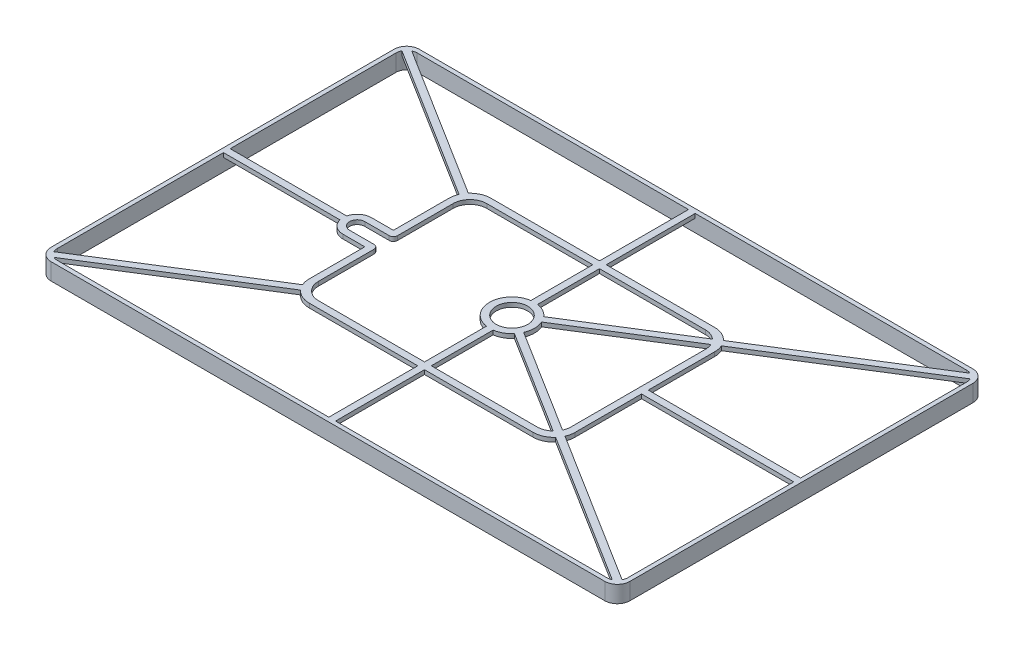
from build123d import *

# Parameters (mm, degrees)
BOSS_EXTRU_1_DEPTH      = 4
ESQUISSE2_R             = 3.75
BOSS_EXTRU_3_DEPTH      = 1
BOSS_EXTRU_4_DEPTH      = 1
ENL_V_MAT_EXTRU_1_DEPTH = 82.630279309
CONG_1_R                = 1


with BuildPart() as part:
    # Esquisse1 → Boss.-Extru.1 (new body)
    with BuildSketch(Plane(origin=(0, 0, 0), x_dir=(1, 0, 0), z_dir=(0, 1, 0))):
        with BuildLine():
            Line((-65.8, 43.75), (65.8, 43.75))
            ThreePointArc((65.8, 43.75), (67.921320344, 42.871320344), (68.8, 40.75))
            Line((68.8, 40.75), (68.8, -40.75))
            ThreePointArc((68.8, -40.75), (67.921320344, -42.871320344), (65.8, -43.75))
            Line((65.8, -43.75), (-65.8, -43.75))
            ThreePointArc((-65.8, -43.75), (-67.921320344, -42.871320344), (-68.8, -40.75))
            Line((-68.8, -40.75), (-68.8, 40.75))
            ThreePointArc((-68.8, 40.75), (-67.921320344, 42.871320344), (-65.8, 43.75))
        make_face()
        with BuildLine():
            Line((-65.3, 42.75), (65.3, 42.75))
            ThreePointArc((65.3, 42.75), (67.067766953, 42.017766953), (67.8, 40.25))
            Line((67.8, 40.25), (67.8, -40.25))
            ThreePointArc((67.8, -40.25), (67.067766953, -42.017766953), (65.3, -42.75))
            Line((65.3, -42.75), (-65.3, -42.75))
            ThreePointArc((-65.3, -42.75), (-67.067766953, -42.017766953), (-67.8, -40.25))
            Line((-67.8, -40.25), (-67.8, 40.25))
            ThreePointArc((-67.8, 40.25), (-67.067766953, 42.017766953), (-65.3, 42.75))
        make_face(mode=Mode.SUBTRACT)
    extrude(amount=BOSS_EXTRU_1_DEPTH)

    # Esquisse2 → Boss.-Extru.3 (add)
    with BuildSketch(Plane(origin=(0, 4, 0), x_dir=(1, 0, 0), z_dir=(0, 1, 0))):
        with BuildLine():
            Line((31.185394692, 18.593528409), (67.917224545, 41.605916277))
            Line((67.917224545, 41.605916277), (67.067766953, 42.961800416))
            Line((67.067766953, 42.961800416), (30.320844752, 19.939957235))
            ThreePointArc((30.320844752, 19.939957235), (28.637181119, 21.166168316), (26.6, 21.6))
            Line((26.6, 21.6), (0.8, 21.6))
            Line((0.8, 21.6), (0.8, 43.322975794))
            Line((0.8, 43.322975794), (-0.8, 43.322975794))
            Line((-0.8, 43.322975794), (-0.8, 21.6))
            Line((-0.8, 21.6), (-26.6, 21.6))
            ThreePointArc((-26.6, 21.6), (-28.637181119, 21.166168316), (-30.320844752, 19.939957235))
            Line((-30.320844752, 19.939957235), (-67.067766953, 42.961800416))
            Line((-67.067766953, 42.961800416), (-67.917224545, 41.605916277))
            Line((-67.917224545, 41.605916277), (-31.185394692, 18.593528409))
            ThreePointArc((-31.185394692, 18.593528409), (-31.495251447, 17.618092958), (-31.6, 16.6))
            Line((-31.6, 16.6), (-31.6, 0.8))
            Line((-31.6, 0.8), (-68.322644777, 0.8))
            Line((-68.322644777, 0.8), (-68.322644777, -0.8))
            Line((-68.322644777, -0.8), (-31.6, -0.8))
            Line((-31.6, -0.8), (-31.6, -16.6))
            ThreePointArc((-31.6, -16.6), (-31.495251447, -17.618092958), (-31.185394692, -18.593528409))
            Line((-31.185394692, -18.593528409), (-67.921921264, -41.608858758))
            Line((-67.921921264, -41.608858758), (-67.072463672, -42.964742898))
            Line((-67.072463672, -42.964742898), (-30.320844752, -19.939957235))
            ThreePointArc((-30.320844752, -19.939957235), (-28.637181119, -21.166168316), (-26.6, -21.6))
            Line((-26.6, -21.6), (-0.8, -21.6))
            Line((-0.8, -21.6), (-0.8, -43.218261979))
            Line((-0.8, -43.218261979), (0.8, -43.218261979))
            Line((0.8, -43.218261979), (0.8, -21.6))
            Line((0.8, -21.6), (26.6, -21.6))
            ThreePointArc((26.6, -21.6), (28.637181119, -21.166168316), (30.320844752, -19.939957235))
            Line((30.320844752, -19.939957235), (66.872148546, -42.839246036))
            Line((66.872148546, -42.839246036), (67.721606138, -41.483361896))
            Line((67.721606138, -41.483361896), (31.185394692, -18.593528409))
            ThreePointArc((31.185394692, -18.593528409), (31.495251447, -17.618092958), (31.6, -16.6))
            Line((31.6, -16.6), (31.6, -0.8))
            Line((31.6, -0.8), (68.284636361, -0.8))
            Line((68.284636361, -0.8), (68.284636361, 0.8))
            Line((68.284636361, 0.8), (31.6, 0.8))
            Line((31.6, 0.8), (31.6, 16.6))
            ThreePointArc((31.6, 16.6), (31.495251447, 17.618092958), (31.185394692, 18.593528409))
        make_face()
        with Locations(Location((0, 0, 0), (0, 0, 270))):
            Circle(ESQUISSE2_R, mode=Mode.SUBTRACT)
        with BuildLine():
            Line((-26, 20), (-0.8, 20))
            Line((-0.8, 20), (-0.8, 5.289848769))
            ThreePointArc((-0.8, 5.289848769), (-5.35, 0), (-0.8, -5.289848769))
            Line((-0.8, -5.289848769), (-0.8, -20))
            Line((-0.8, -20), (-26, -20))
            ThreePointArc((-26, -20), (-28.828427125, -18.828427125), (-30, -16))
            Line((-30, -16), (-30, 16))
            ThreePointArc((-30, 16), (-28.828427125, 18.828427125), (-26, 20))
        make_face(mode=Mode.SUBTRACT)
        with BuildLine():
            Line((30, 16), (30, -16))
            ThreePointArc((30, -16), (29.91194143, -16.834694103), (29.651642878, -17.632637221))
            Line((29.651642878, -17.632637221), (4.907492575, -2.130496802))
            ThreePointArc((4.907492575, -2.130496802), (5.35, 0), (4.907492575, 2.130496802))
            Line((4.907492575, 2.130496802), (29.651642878, 17.632637221))
            ThreePointArc((29.651642878, 17.632637221), (29.91194143, 16.834694103), (30, 16))
        make_face(mode=Mode.SUBTRACT)
        with BuildLine():
            Line((0.8, 20), (0.8, 5.289848769))
            ThreePointArc((0.8, 5.289848769), (2.590994023, 4.680731778), (4.058034983, 3.486380942))
            Line((4.058034983, 3.486380942), (28.717305938, 18.935344688))
            ThreePointArc((28.717305938, 18.935344688), (27.459215756, 19.724337441), (26, 20))
            Line((26, 20), (0.8, 20))
        make_face(mode=Mode.SUBTRACT)
        with BuildLine():
            Line((0.8, -20), (0.8, -5.289848769))
            ThreePointArc((0.8, -5.289848769), (2.590994023, -4.680731778), (4.058034983, -3.486380942))
            Line((4.058034983, -3.486380942), (28.717305938, -18.935344688))
            ThreePointArc((28.717305938, -18.935344688), (27.459215756, -19.724337441), (26, -20))
            Line((26, -20), (0.8, -20))
        make_face(mode=Mode.SUBTRACT)
    extrude(amount=-BOSS_EXTRU_3_DEPTH)

    # Esquisse3 → Boss.-Extru.4 (add)
    with BuildSketch(Plane(origin=(0, 4, 0), x_dir=(1, 0, 0), z_dir=(0, 1, 0))):
        with BuildLine():
            Line((-31.6, 7.246102482), (-30, 7.246102482))
            Line((-30, 7.246102482), (-30, -10.710151561))
            Line((-30, -10.710151561), (-31.6, -10.710151561))
            Line((-31.6, -10.710151561), (-31.6, -3.4))
            Line((-31.6, -3.4), (-36.8, -3.4))
            ThreePointArc((-36.8, -3.4), (-40.2, 0), (-36.8, 3.4))
            Line((-36.8, 3.4), (-31.6, 3.4))
            Line((-31.6, 3.4), (-31.6, 7.246102482))
        make_face()
        with BuildLine():
            Line((-36.8, 1.8), (-33.91555898, 1.8))
            Line((-33.91555898, 1.8), (-31.6, 1.8))
            Line((-31.6, 1.8), (-31.6, -1.8))
            Line((-31.6, -1.8), (-33.91555898, -1.8))
            Line((-33.91555898, -1.8), (-36.8, -1.8))
            ThreePointArc((-36.8, -1.8), (-38.6, 0), (-36.8, 1.8))
        make_face(mode=Mode.SUBTRACT)
    extrude(amount=-BOSS_EXTRU_4_DEPTH)

    # Esquisse4 → Enlèv. mat.-Extru.1 (cut, through all)
    with BuildSketch(Plane(origin=(0, 4, 0), x_dir=(1, 0, 0), z_dir=(0, 1, 0))):
        with BuildLine():
            Line((-36.8, 1.8), (-28.230544018, 1.8))
            Line((-28.230544018, 1.8), (-28.230544018, -1.8))
            Line((-28.230544018, -1.8), (-36.8, -1.8))
            ThreePointArc((-36.8, -1.8), (-38.6, 0), (-36.8, 1.8))
        make_face()
    extrude(amount=-ENL_V_MAT_EXTRU_1_DEPTH, mode=Mode.SUBTRACT)

    # Congé1
    cong_1_edges = [part.edges().sort_by_distance(p)[0] for p in [
        (-30, 3.5, -1.8),
        (-30, 3.5, 1.8),
    ]]
    fillet(cong_1_edges, radius=CONG_1_R)


solid = part.part
